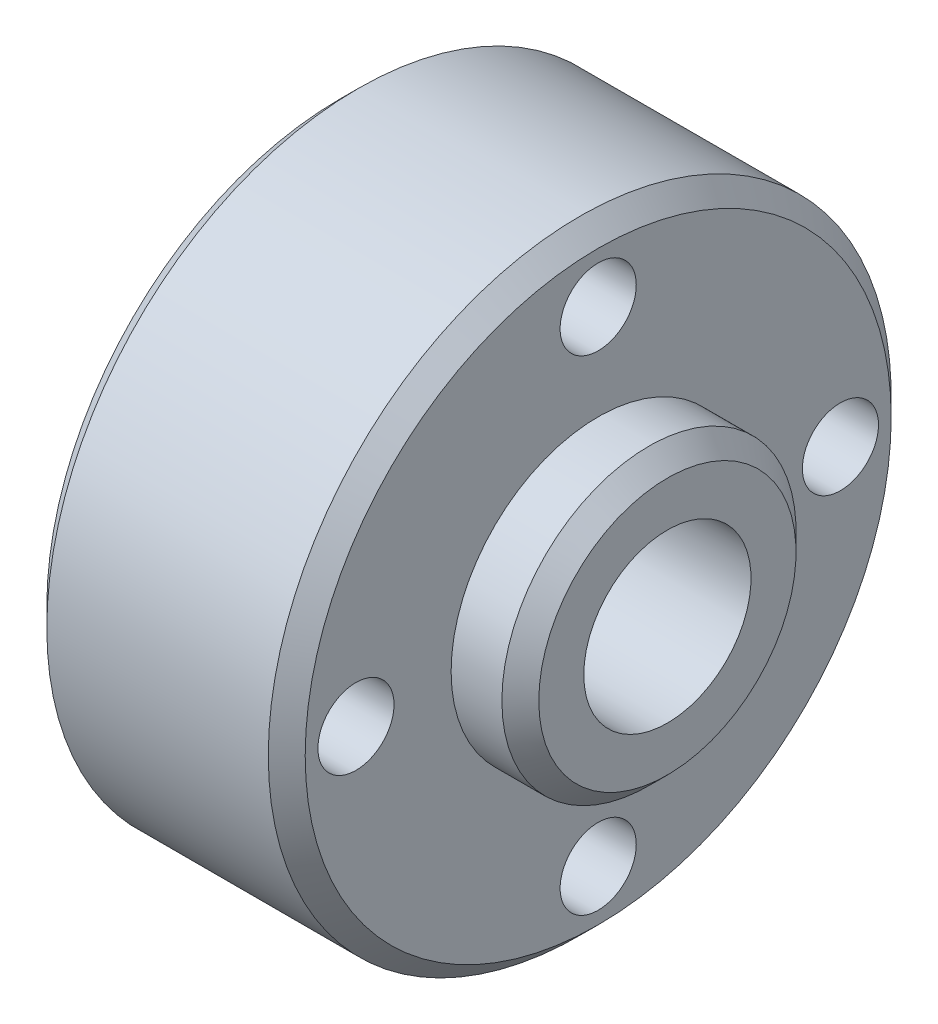
from build123d import *

# Parameters (mm, degrees)
SKETCH_2_R          = 1.65
CUT_EXTRUDE_1_DEPTH = 23.134588318
CHAMFER_1_SIZE      = 0.8


with BuildPart() as part:
    # 草图1 → 旋转1 (revolve)
    with BuildSketch(Plane.XY, mode=Mode.PRIVATE) as revolve_1_sk:
        Polygon((0, 13.5), (11.2, 13.5), (11.2, 6.375), (14.2, 6.375), (14.2, 3.625), (7, 3.625), (7, 7.625), (0, 7.625), align=None)
    revolve(revolve_1_sk.sketch.rotate(Axis((0, 0, 0), (1, 0, 0)), 90), axis=Axis((0, 0, 0), (1, 0, 0)))

    # 草图2 → 切除-拉伸1 (cut, through all)
    with BuildSketch(Plane(origin=(11.2, 0, 0), x_dir=(0, 0, -1), z_dir=(1, 0, 0))):
        with Locations((0, 10.5)):
            Circle(SKETCH_2_R)
        with Locations((10.5, 0)):
            Circle(SKETCH_2_R)
        with Locations((0, -10.5)):
            Circle(SKETCH_2_R)
        with Locations((-10.5, 0)):
            Circle(SKETCH_2_R)
    extrude(amount=-CUT_EXTRUDE_1_DEPTH, mode=Mode.SUBTRACT)

    # 倒角1
    chamfer_1_edges = [part.edges().sort_by_distance(p)[0] for p in [
        (0, 0, -7.625),
        (0, 0, -13.5),
        (11.2, 0, -13.5),
        (14.2, 0, -6.375),
    ]]
    chamfer(chamfer_1_edges, length=CHAMFER_1_SIZE)


solid = part.part
